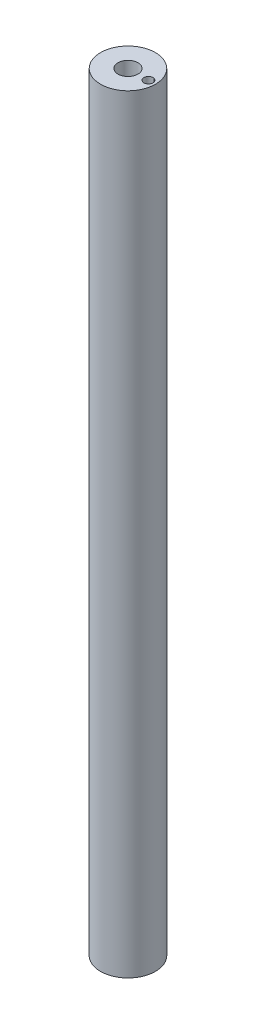
from build123d import *

# Parameters (mm, degrees)
SKETCH1_R                                    = 4.7625
BOSS_EXTRUDE1_DEPTH                          = 133.35
F_8_32_TAPPED_HOLE1_D                        = 3.4544
F_8_32_TAPPED_HOLE1_DEPTH                    = 10.668
F_8_32_TAPPED_HOLE1_TIP                      = 1.037806461
F_8_32_TAPPED_HOLE1_ON_FACE_2_D              = 3.4544
F_8_32_TAPPED_HOLE1_ON_FACE_2_DEPTH          = 10.668
F_8_32_TAPPED_HOLE1_ON_FACE_2_TIP            = 1.037806461
F_1_16_0_0625_DIAMETER_HOLE1_D               = 1.5875
F_1_16_0_0625_DIAMETER_HOLE1_DEPTH           = 4.7625
F_1_16_0_0625_DIAMETER_HOLE1_TIP             = 0.476933116
F_1_16_0_0625_DIAMETER_HOLE1_ON_FACE_2_D     = 1.5875
F_1_16_0_0625_DIAMETER_HOLE1_ON_FACE_2_DEPTH = 4.7625
F_1_16_0_0625_DIAMETER_HOLE1_ON_FACE_2_TIP   = 0.476933116


with BuildPart() as part:
    # Sketch1 → Boss-Extrude1 (new body)
    with BuildSketch(Plane(origin=(0, 0, 0), x_dir=(1, 0, 0), z_dir=(0, 1, 0))):
        with Locations(Location((0, 0, 0), (0, 0, 270))):
            Circle(SKETCH1_R)
    extrude(amount=BOSS_EXTRUDE1_DEPTH)

    # #8-32 Tapped Hole1
    with Locations(Plane.ZX.offset(133.35)):
        with Locations((0, 0)):
            Hole(F_8_32_TAPPED_HOLE1_D / 2, depth=F_8_32_TAPPED_HOLE1_DEPTH)
            with Locations((0, 0, -(F_8_32_TAPPED_HOLE1_DEPTH + F_8_32_TAPPED_HOLE1_TIP / 2))):  # 118° drill point
                Cone(0, F_8_32_TAPPED_HOLE1_D / 2, F_8_32_TAPPED_HOLE1_TIP, mode=Mode.SUBTRACT)

    # #8-32 Tapped Hole1 on face 2
    with Locations(Plane(origin=(0, 0, 0), x_dir=(0, 0, -1), z_dir=(0, -1, 0))):
        with Locations((0, 0)):
            Hole(F_8_32_TAPPED_HOLE1_ON_FACE_2_D / 2, depth=F_8_32_TAPPED_HOLE1_ON_FACE_2_DEPTH)
            with Locations((0, 0, -(F_8_32_TAPPED_HOLE1_ON_FACE_2_DEPTH + F_8_32_TAPPED_HOLE1_ON_FACE_2_TIP / 2))):  # 118° drill point
                Cone(0, F_8_32_TAPPED_HOLE1_ON_FACE_2_D / 2, F_8_32_TAPPED_HOLE1_ON_FACE_2_TIP, mode=Mode.SUBTRACT)

    # 1/16 (0.0625) Diameter Hole1
    with Locations(Plane(origin=(3.556, 0, 0), x_dir=(0, 0, -1), z_dir=(0, -1, 0))):
        with Locations((0, 0)):
            Hole(F_1_16_0_0625_DIAMETER_HOLE1_D / 2, depth=F_1_16_0_0625_DIAMETER_HOLE1_DEPTH)
            with Locations((0, 0, -(F_1_16_0_0625_DIAMETER_HOLE1_DEPTH + F_1_16_0_0625_DIAMETER_HOLE1_TIP / 2))):  # 118° drill point
                Cone(0, F_1_16_0_0625_DIAMETER_HOLE1_D / 2, F_1_16_0_0625_DIAMETER_HOLE1_TIP, mode=Mode.SUBTRACT)

    # 1/16 (0.0625) Diameter Hole1 on face 2
    with Locations(Plane(origin=(3.556, 133.35, 0), x_dir=(0, 0, 1), z_dir=(0, 1, 0))):
        with Locations((0, 0)):
            Hole(F_1_16_0_0625_DIAMETER_HOLE1_ON_FACE_2_D / 2, depth=F_1_16_0_0625_DIAMETER_HOLE1_ON_FACE_2_DEPTH)
            with Locations((0, 0, -(F_1_16_0_0625_DIAMETER_HOLE1_ON_FACE_2_DEPTH + F_1_16_0_0625_DIAMETER_HOLE1_ON_FACE_2_TIP / 2))):  # 118° drill point
                Cone(0, F_1_16_0_0625_DIAMETER_HOLE1_ON_FACE_2_D / 2, F_1_16_0_0625_DIAMETER_HOLE1_ON_FACE_2_TIP, mode=Mode.SUBTRACT)


solid = part.part
